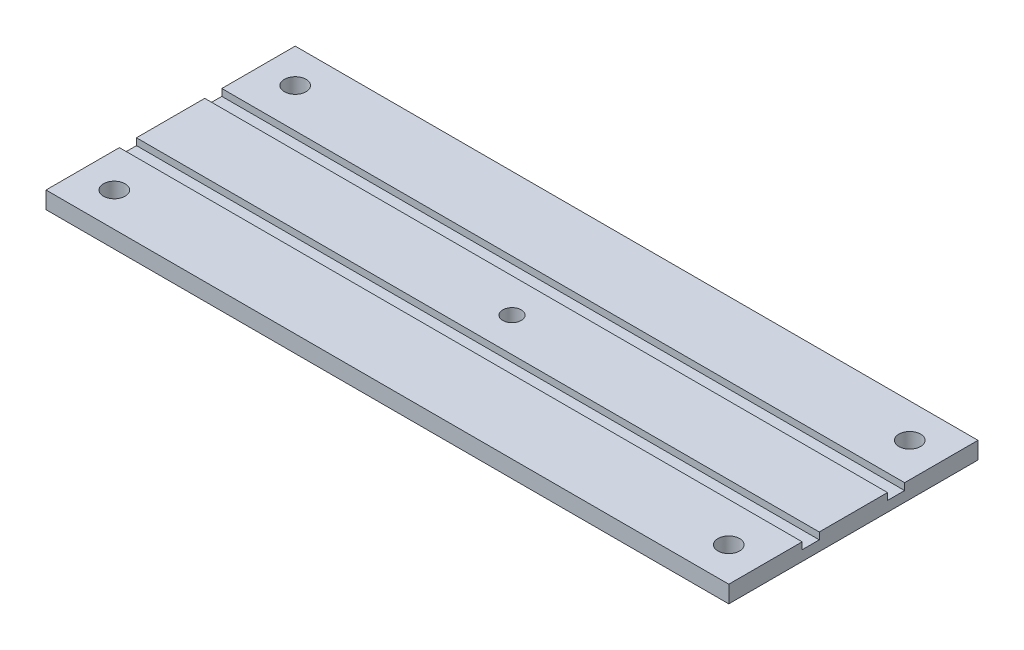
from build123d import *

# Parameters (mm, degrees)
SKETCH1_W                   = 200
SKETCH1_H                   = 73
RIGHT_WALL_DEPTH            = 5
F_1_4_0_2500_DOWEL_HOLE1_D  = 6.35
TAP_DRILL_FOR_1_4_28_TAP2_D = 5.4102
SKETCH24_W                  = 200
SKETCH24_H                  = 5
CUT_EXTRUDE1_DEPTH          = 2


with BuildPart() as part:
    # Sketch1 → right wall (new body)
    with BuildSketch(Plane(origin=(0, 0, 0), x_dir=(1, 0, 0), z_dir=(0, 1, 0))):
        with Locations((100, 36.5)):
            Rectangle(SKETCH1_W, SKETCH1_H)
    extrude(amount=RIGHT_WALL_DEPTH)

    # 1/4 (0.2500) Dowel Hole1 (through all)
    with Locations(Plane(origin=(0, 0, 0), x_dir=(-1, 0, 0), z_dir=(0, -1, 0))):
        with Locations((-10, 10), (-10, 63), (-190, 63), (-190, 10)):
            Hole(F_1_4_0_2500_DOWEL_HOLE1_D / 2)

    # Tap Drill for 1/4-28 Tap2 (through all)
    with Locations(Plane(origin=(0, 0, 0), x_dir=(-1, 0, 0), z_dir=(0, -1, 0))):
        with Locations((-100, 36.5)):
            Hole(TAP_DRILL_FOR_1_4_28_TAP2_D / 2)

    # Sketch24 → Cut-Extrude1 (cut)
    with BuildSketch(Plane(origin=(0, 5, 0), x_dir=(1, 0, 0), z_dir=(0, 1, 0))):
        with Locations((100, 49)):
            Rectangle(SKETCH24_W, SKETCH24_H)
        with Locations((100, 24)):
            Rectangle(SKETCH24_W, SKETCH24_H)
    extrude(amount=-CUT_EXTRUDE1_DEPTH, mode=Mode.SUBTRACT)


solid = part.part
